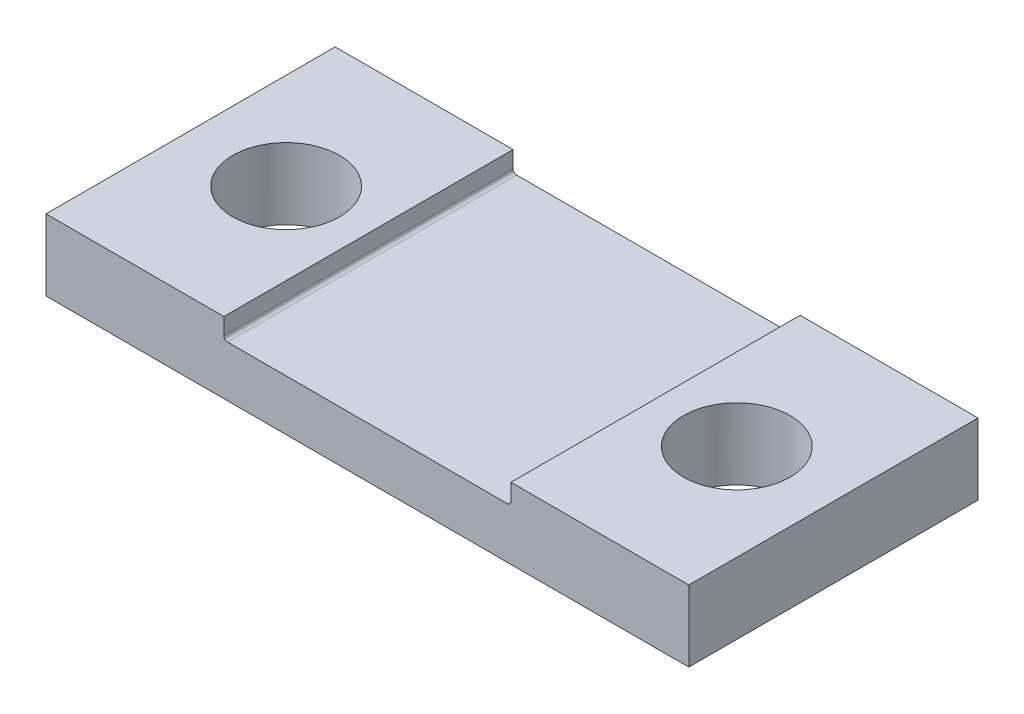
from build123d import *

# Parameters (mm, degrees)
BOSS_EXTRUDE1_DEPTH       = 8.13
F_3_0MM_DOWEL_HOLE1_D     = 3
F_3_0MM_DOWEL_HOLE1_DEPTH = 35
F_3_0MM_DOWEL_HOLE1_TIP   = 0.901290929


with BuildPart() as part:
    # Sketch1 → Boss-Extrude1 (new body)
    with BuildSketch(Plane.XY):
        with BuildLine():
            Line((-9.035, 0), (-9.035, 2))
            Line((-9.035, 2), (-4.035, 2))
            Line((-4.035, 2), (-4.035, 1.53))
            ThreePointArc((-4.035, 1.53), (-4.005710678, 1.459289322), (-3.935, 1.43))
            Line((-3.935, 1.43), (3.935, 1.43))
            ThreePointArc((3.935, 1.43), (4.005710678, 1.459289322), (4.035, 1.53))
            Line((4.035, 1.53), (4.035, 2))
            Line((4.035, 2), (9.035, 2))
            Line((9.035, 2), (9.035, 0))
            Line((9.035, 0), (-9.035, 0))
        make_face()
    extrude(amount=BOSS_EXTRUDE1_DEPTH)

    # Ø3.0mm Dowel Hole1
    with Locations(Plane(origin=(0, 2, 0), x_dir=(1, 0, 0), z_dir=(0, 1, 0))):
        with Locations((6.335, -4.08), (-6.335, -4.08)):
            Hole(F_3_0MM_DOWEL_HOLE1_D / 2, depth=F_3_0MM_DOWEL_HOLE1_DEPTH)
            with Locations((0, 0, -(F_3_0MM_DOWEL_HOLE1_DEPTH + F_3_0MM_DOWEL_HOLE1_TIP / 2))):  # 118° drill point
                Cone(0, F_3_0MM_DOWEL_HOLE1_D / 2, F_3_0MM_DOWEL_HOLE1_TIP, mode=Mode.SUBTRACT)


solid = part.part
